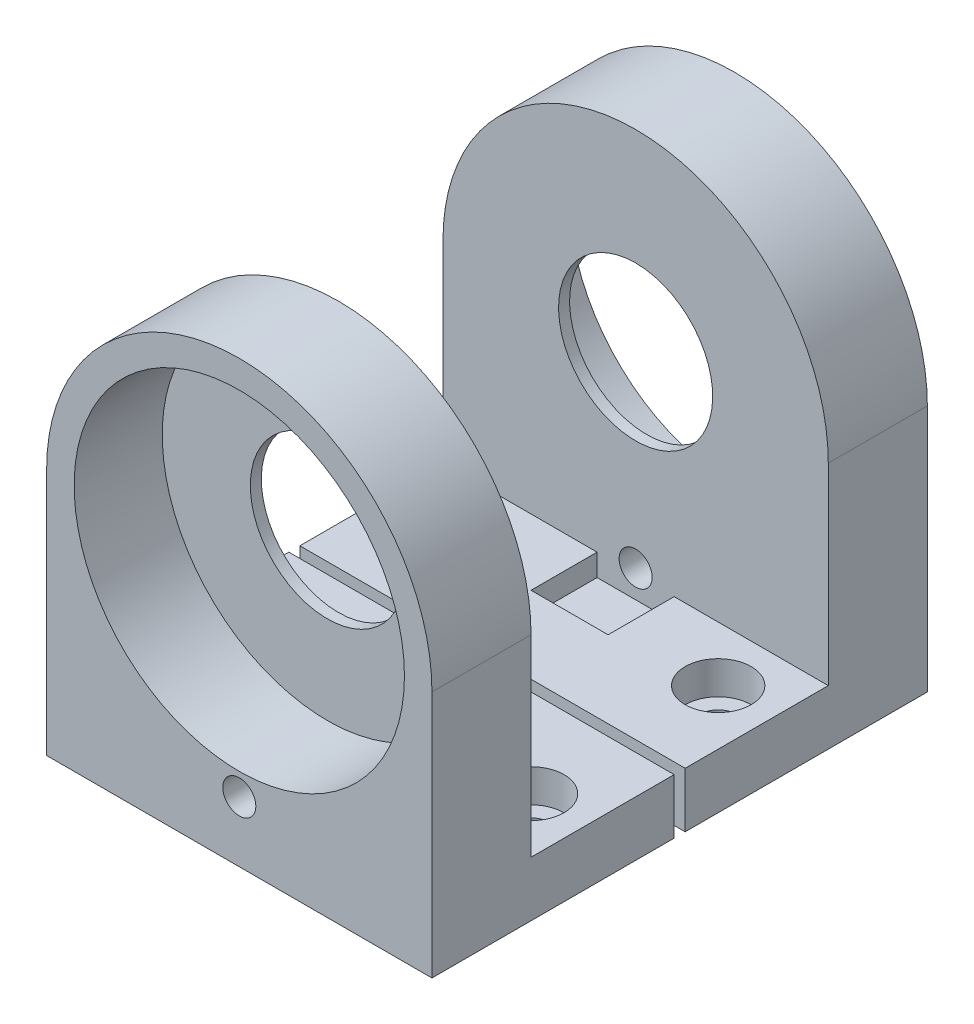
from build123d import *

# Parameters (mm, degrees)
EXTRUDE_1_DEPTH          = 17.5
CUT_EXTRUDE_1_DEPTH      = 63.69968102
CUT_EXTRUDE_1_DEPTH_BACK = 63.69968102
SKETCH_6_R               = 1.55
CUT_EXTRUDE_4_DEPTH      = 46.138675213
SKETCH_7_R               = 15
CUT_EXTRUDE_5_DEPTH      = 8
SKETCH_8_R               = 7
CUT_EXTRUDE_6_DEPTH      = 2
SKETCH_9_R               = 1.5
CUT_EXTRUDE_7_DEPTH      = 14
SKETCH_10_W              = 7
SKETCH_10_H              = 6
CUT_EXTRUDE_8_DEPTH      = 2
SKETCH_15_W              = 35
SKETCH_15_H              = 1
CUT_EXTRUDE_9_DEPTH      = 10
SKETCH_16_R              = 3
CUT_EXTRUDE_10_DEPTH     = 3


with BuildPart() as part:
    # 草图1 → 凸台-拉伸1 (new, symmetric)
    with BuildSketch(Plane(origin=(0, 0, 0), x_dir=(0, 0, -1), z_dir=(1, 0, 0))):
        Polygon((22.5, 0), (-22.5, 0), (-22.5, 40), (-13.5, 40), (-13.5, 5), (13.5, 5), (13.5, 40), (22.5, 40), align=None)
    extrude(amount=EXTRUDE_1_DEPTH, both=True)

    # 草图2 → 切除-拉伸1 (cut, two sides: drawn at the far end of the back side and taken through both)
    with BuildSketch(Plane.XY.offset(22.5).offset(-CUT_EXTRUDE_1_DEPTH_BACK)):
        with BuildLine():
            ThreePointArc((-17.5, 22.5), (-12.374368671, 34.874368671), (0, 40))
            Line((0, 40), (-17.5, 40))
            Line((-17.5, 40), (-17.5, 22.5))
        make_face()
        with BuildLine():
            Line((17.5, 22.5), (17.5, 40))
            Line((17.5, 40), (0, 40))
            ThreePointArc((0, 40), (12.374368671, 34.874368671), (17.5, 22.5))
        make_face()
    extrude(amount=CUT_EXTRUDE_1_DEPTH + CUT_EXTRUDE_1_DEPTH_BACK, mode=Mode.SUBTRACT)

    # 草图6 → 切除-拉伸4 (cut, through all)
    with BuildSketch(Plane(origin=(0, 5, 0), x_dir=(1, 0, 0), z_dir=(0, 1, 0))):
        with Locations(Location((-12.5, 8.5, 0), (0, 0, 270))):
            Circle(SKETCH_6_R)
        with Locations(Location((12.5, 8.5, 0), (0, 0, 90))):
            Circle(SKETCH_6_R)
        with Locations(Location((12.5, -8.5, 0), (0, 0, 270))):
            Circle(SKETCH_6_R)
        with Locations(Location((-12.5, -8.5, 0), (0, 0, 90))):
            Circle(SKETCH_6_R)
    extrude(amount=-CUT_EXTRUDE_4_DEPTH, mode=Mode.SUBTRACT)

    # 草图7 → 切除-拉伸5 (cut)
    with BuildSketch(Plane.XY.offset(22.5)):
        with Locations((0, 22.5)):
            Circle(SKETCH_7_R)
    cut_extrude_5 = extrude(amount=-CUT_EXTRUDE_5_DEPTH, mode=Mode.SUBTRACT)

    # 草图8 → 切除-拉伸6 (cut)
    with BuildSketch(Plane.XY.offset(14.5)):
        with Locations((0, 22.5)):
            Circle(SKETCH_8_R)
    cut_extrude_6 = extrude(amount=-CUT_EXTRUDE_6_DEPTH, mode=Mode.SUBTRACT)

    # 镜向1: 切除-拉伸5, 切除-拉伸6 across plane
    add(cut_extrude_5.mirror(Plane.XY), mode=Mode.SUBTRACT)
    add(cut_extrude_6.mirror(Plane.XY), mode=Mode.SUBTRACT)

    # 草图9 → 切除-拉伸7 (cut)
    with BuildSketch(Plane(origin=(0, 0, -22.5), x_dir=(-1, 0, 0), z_dir=(0, 0, -1))):
        with Locations(Location((0, 5.5, 0), (0, 0, 90))):
            Circle(SKETCH_9_R)
    cut_extrude_7 = extrude(amount=-CUT_EXTRUDE_7_DEPTH, mode=Mode.SUBTRACT)

    # 草图10 → 切除-拉伸8 (cut)
    with BuildSketch(Plane(origin=(0, 5, 0), x_dir=(1, 0, 0), z_dir=(0, 1, 0))):
        with Locations((0, 10.5)):
            Rectangle(SKETCH_10_W, SKETCH_10_H)
    cut_extrude_8 = extrude(amount=-CUT_EXTRUDE_8_DEPTH, mode=Mode.SUBTRACT)

    # 镜向2: 切除-拉伸7, 切除-拉伸8 across plane
    add(cut_extrude_7.mirror(Plane.XY), mode=Mode.SUBTRACT)
    add(cut_extrude_8.mirror(Plane.XY), mode=Mode.SUBTRACT)

    # 草图15 → 切除-拉伸9 (cut)
    with BuildSketch(Plane(origin=(0, 5, 0), x_dir=(1, 0, 0), z_dir=(0, 1, 0))):
        Rectangle(SKETCH_15_W, SKETCH_15_H)
    extrude(amount=-CUT_EXTRUDE_9_DEPTH, mode=Mode.SUBTRACT)


with BuildPart() as cut_extrude_9_piece_1:
    # of the separate pieces the step leaves, piece 1, a body of its own (cut_extrude_9_pieces)
    add(part.part.solids().sort_by_distance((-17.5, 0, -22.5))[0])


with BuildPart() as cut_extrude_9_piece_2:
    # of the separate pieces the step leaves, piece 2, a body of its own (cut_extrude_9_pieces)
    add(part.part.solids().sort_by_distance((17.5, 0, 0.5))[0])


with BuildPart() as cut_extrude_10_tool:
    # 草图16 → 切除-拉伸10 (new body)
    with BuildSketch(Plane(origin=(0, 5, 0), x_dir=(1, 0, 0), z_dir=(0, 1, 0))):
        with Locations(Location((-12.5, 8.5, 0), (0, 0, 270))):
            Circle(SKETCH_16_R)
        with Locations(Location((12.5, 8.5, 0), (0, 0, 270))):
            Circle(SKETCH_16_R)
        with Locations(Location((12.5, -8.5, 0), (0, 0, 270))):
            Circle(SKETCH_16_R)
        with Locations(Location((-12.5, -8.5, 0), (0, 0, 270))):
            Circle(SKETCH_16_R)
    extrude(amount=-CUT_EXTRUDE_10_DEPTH)


with BuildPart() as cut_extrude_9_piece_1_1:
    add(cut_extrude_9_piece_1.part)

    # 切除-拉伸10: cut by cut_extrude_10_tool
    add(cut_extrude_10_tool.part, mode=Mode.SUBTRACT)


with BuildPart() as cut_extrude_9_piece_2_1:
    add(cut_extrude_9_piece_2.part)

    # 切除-拉伸10: cut by cut_extrude_10_tool
    add(cut_extrude_10_tool.part, mode=Mode.SUBTRACT)


solid = Compound([cut_extrude_9_piece_1_1.part, cut_extrude_9_piece_2_1.part])
